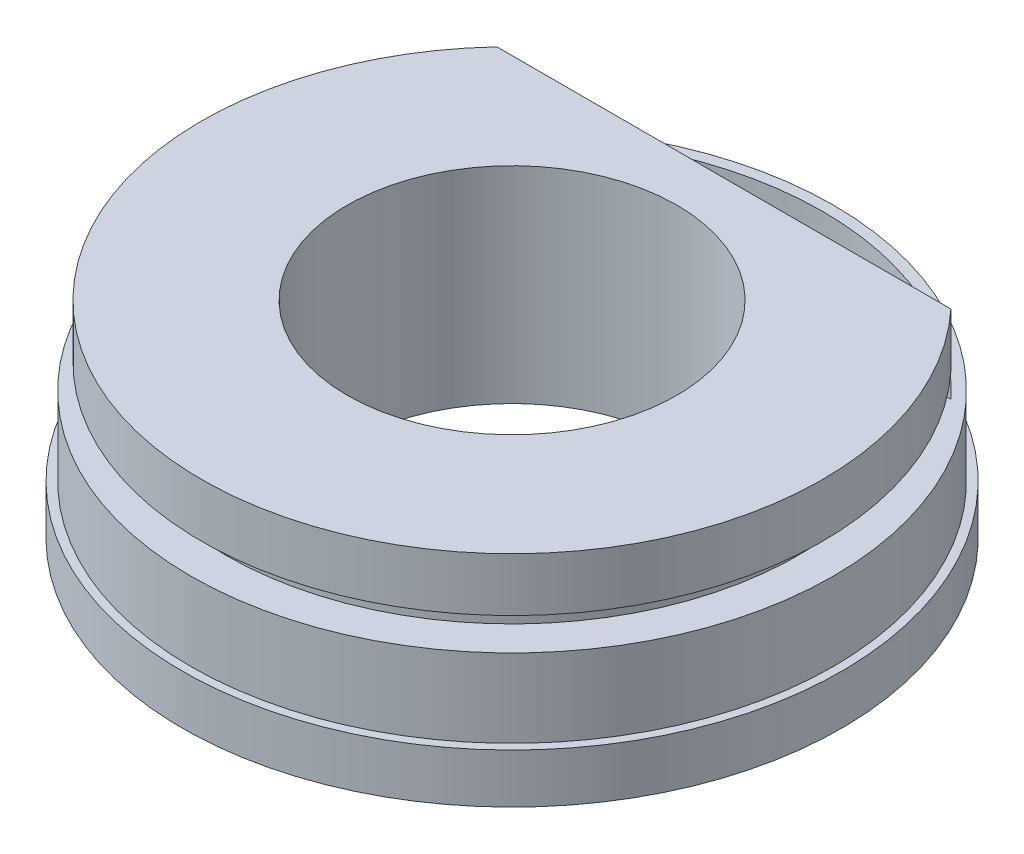
from build123d import *

# Parameters (mm, degrees)
CUT_EXTRUDE3_DEPTH = 10


with BuildPart() as part:
    # Sketch1 → Revolve2 (revolve)
    with BuildSketch(Plane.XY, mode=Mode.PRIVATE) as revolve2_sk:
        Polygon((10, 0), (20, 0), (20, 3), (19.5, 3), (19.5, 7.75), (17.343396893, 7.75), (17.343396893, 9.25), (18.843396893, 9.25), (18.843396893, 12.5), (10, 12.5), align=None)
    revolve(revolve2_sk.sketch.rotate(Axis((0, 0, 0), (0, 1, 0)), 90), axis=Axis((0, 0, 0), (0, 1, 0)))

    # Sketch2 → Cut-Extrude3 (cut)
    with BuildSketch(Plane(origin=(0, 12.5, 0), x_dir=(1, 0, 0), z_dir=(0, 1, 0))):
        with BuildLine():
            ThreePointArc((13.776115673, 12.856603107), (0, 18.843396893), (-13.776115673, 12.856603107))
            Line((-13.776115673, 12.856603107), (13.776115673, 12.856603107))
        make_face()
    extrude(amount=-CUT_EXTRUDE3_DEPTH, mode=Mode.SUBTRACT)


solid = part.part
